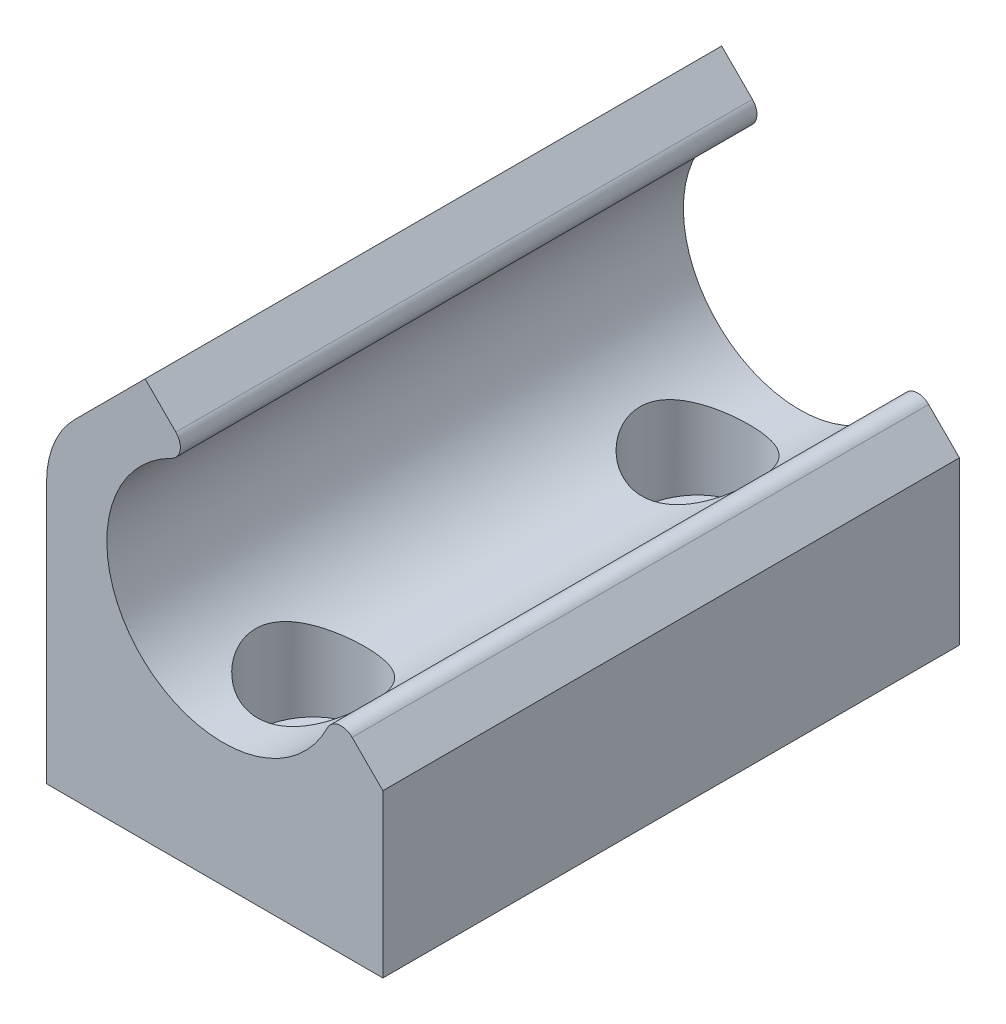
from build123d import *

# Parameters (mm, degrees)
BOSS_EXTRUDE1_DEPTH = 30
FILLET1_R           = 0.8
SKETCH3_R           = 3
CUT_EXTRUDE1_DEPTH  = 7
SKETCH4_R           = 1.55
CUT_EXTRUDE2_DEPTH  = 37.426390381
FILLET2_R           = 5


with BuildPart() as part:
    # Sketch1 → Boss-Extrude1 (new body)
    with BuildSketch(Plane.XY):
        with BuildLine():
            Line((0, 0), (17.5, 0))
            Line((17.5, 0), (17.5, 8.44))
            Line((17.5, 8.44), (15.025126266, 10.914873734))
            ThreePointArc((15.025126266, 10.914873734), (4.907782078, 8.219443047), (7.603212766, 18.336787234))
            Line((7.603212766, 18.336787234), (5.128339032, 20.811660968))
            Line((5.128339032, 20.811660968), (0, 15.683321936))
            Line((0, 15.683321936), (0, 0))
        make_face()
    extrude(amount=BOSS_EXTRUDE1_DEPTH)

    # Fillet1
    fillet1_edges = [part.edges().sort_by_distance(p)[0] for p in [
        (7.603212766, 18.336787234, 15),
        (15.025126266, 10.914873734, 15),
    ]]
    fillet(fillet1_edges, radius=FILLET1_R)

    # Sketch3 → Cut-Extrude1 (cut)
    with BuildSketch(Plane(origin=(0, 9.828405067, 0), x_dir=(-1, 0, 0), z_dir=(0, -1, 0))):
        with Locations(Location((-8.875495285, -5, 0), (0, 0, 270))):
            Circle(SKETCH3_R)
        with Locations(Location((-8.875495285, -25, 0), (0, 0, 270))):
            Circle(SKETCH3_R)
    extrude(amount=CUT_EXTRUDE1_DEPTH, mode=Mode.SUBTRACT)

    # Sketch4 → Cut-Extrude2 (cut, through all)
    with BuildSketch(Plane(origin=(0, 9.828405067, 0), x_dir=(-1, 0, 0), z_dir=(0, -1, 0))):
        with Locations(Location((-8.875495285, -5, 0), (0, 0, 90))):
            Circle(SKETCH4_R)
        with Locations(Location((-8.875495285, -25, 0), (0, 0, 90))):
            Circle(SKETCH4_R)
    extrude(amount=CUT_EXTRUDE2_DEPTH, mode=Mode.SUBTRACT)

    # Fillet2
    fillet2_edges = [part.edges().sort_by_distance(p)[0] for p in [
        (0, 15.683321936, 15),
    ]]
    fillet(fillet2_edges, radius=FILLET2_R)


solid = part.part
